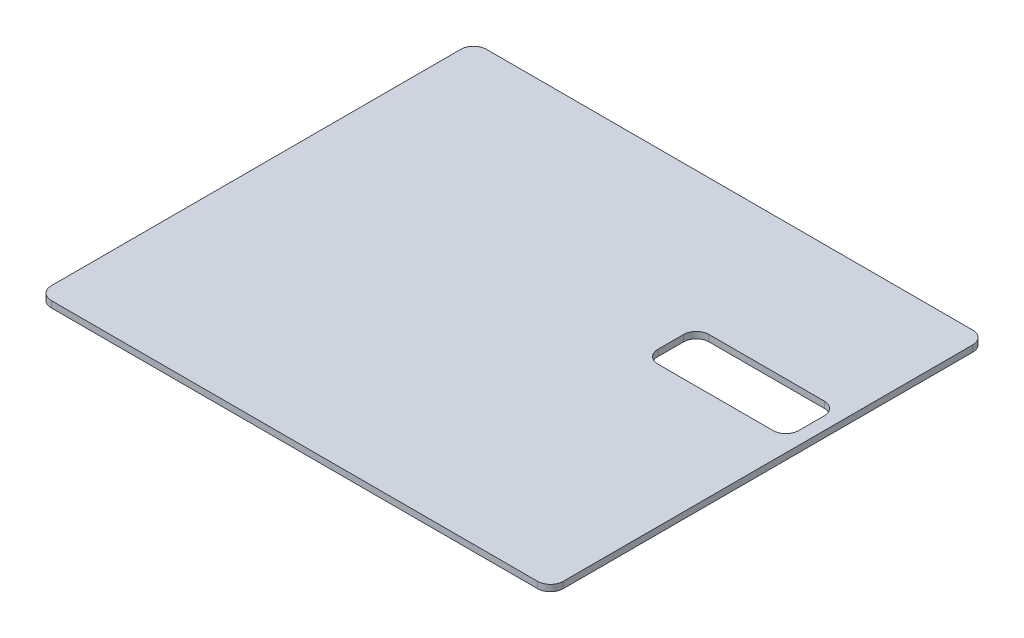
from build123d import *

# Parameters (mm, degrees)
SKETCH1_W           = 69.85
SKETCH1_H           = 25.4
BOSS_EXTRUDE1_DEPTH = 3.175
FILLET1_R           = 6.35


with BuildPart() as part:
    # Sketch1 → Boss-Extrude1 (new body)
    with BuildSketch(Plane(origin=(0, 0, 0), x_dir=(1, 0, 0), z_dir=(0, 1, 0))):
        Polygon((254, 148.59), (254, 215.9), (0, 215.9), (0, 0), (254, 0), (254, 123.19), align=None)
        with Locations((212.725, 135.89)):
            Rectangle(SKETCH1_W, SKETCH1_H, mode=Mode.SUBTRACT)
    extrude(amount=BOSS_EXTRUDE1_DEPTH)

    # Fillet1
    fillet1_edges = [part.edges().sort_by_distance(p)[0] for p in [
        (0, 1.5875, -215.9),
        (254, 1.5875, -215.9),
        (254, 1.5875, 0),
        (0, 1.5875, 0),
        (177.8, 1.5875, -148.59),
        (177.8, 1.5875, -123.19),
        (247.65, 1.5875, -123.19),
        (247.65, 1.5875, -148.59),
    ]]
    fillet(fillet1_edges, radius=FILLET1_R)


solid = part.part
